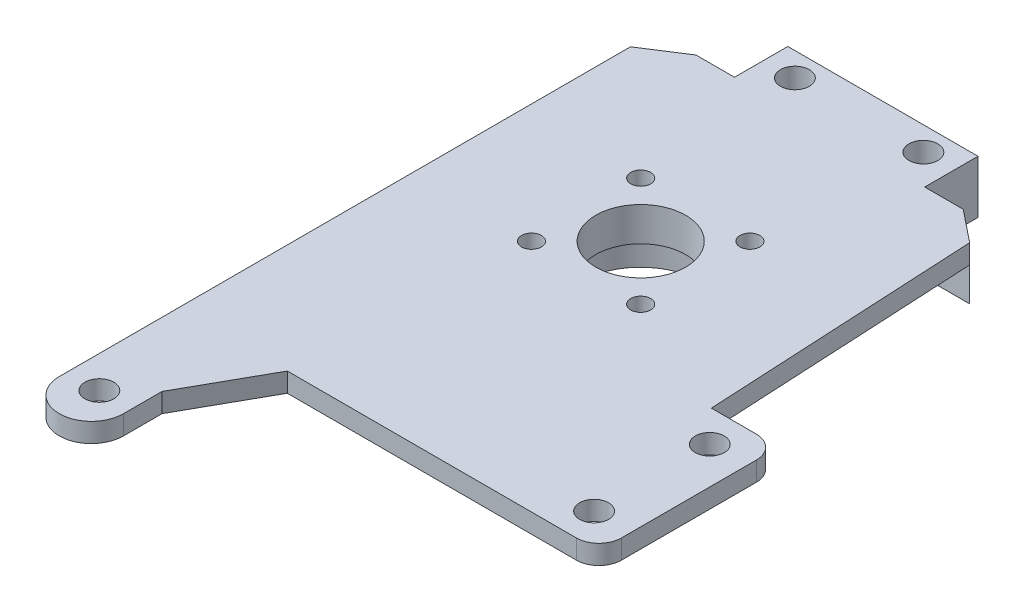
from build123d import *

# Parameters (mm, degrees)
SKETCH1_R                = 12.6
SKETCH1_R_2              = 2.25
BOSS_EXTRUDE1_DEPTH      = 3
BOSS_EXTRUDE2_DEPTH      = 3
BOSS_EXTRUDE2_DEPTH_BACK = 7.3
SKETCH1_23_R             = 12.6
SKETCH1_23_R_2           = 9.6
BOSS_EXTRUDE3_DEPTH      = 3
BOSS_EXTRUDE3_DEPTH_BACK = 2.3
SKETCH1_24_R             = 9.6
SKETCH1_24_R_2           = 7
CUT_EXTRUDE1_DEPTH       = 110.735090103
CUT_EXTRUDE1_DEPTH_BACK  = 110.735090103
SKETCH2_R                = 7
SKETCH2_R_2              = 1.55
BOSS_EXTRUDE4_DEPTH      = 3
BOSS_EXTRUDE4_DEPTH_BACK = 5.25
SKETCH1_25_R             = 2.25


with BuildPart() as part:
    # Sketch1 → Boss-Extrude1 (new body)
    with BuildSketch(Plane(origin=(0, 0, 0), x_dir=(1, 0, 0), z_dir=(0, 1, 0))):
        with BuildLine():
            Line((-20.8, -4.6), (-27, -8.6))
            Line((-27, -8.6), (-27, -97.5))
            ThreePointArc((-27, -97.5), (-22, -102.5), (-17, -97.5))
            Line((-17, -97.5), (-17, -91.5))
            Line((-17, -91.5), (-10, -79))
            Line((-10, -79), (35, -79))
            ThreePointArc((35, -79), (37.474873734, -77.974873734), (38.5, -75.5))
            Line((38.5, -75.5), (38.5, -54.5))
            ThreePointArc((38.5, -54.5), (37.474873734, -52.025126266), (35, -51))
            Line((35, -51), (28, -51))
            Line((28, -51), (25.8, -8.6))
            Line((25.8, -8.6), (20.8, -4.6))
            Line((20.8, -4.6), (-20.8, -4.6))
        make_face()
        with Locations((0, -34)):
            Circle(SKETCH1_R, mode=Mode.SUBTRACT)
        with Locations((32.75, -56)):
            Circle(SKETCH1_R_2, mode=Mode.SUBTRACT)
        with Locations((32.75, -74)):
            Circle(SKETCH1_R_2, mode=Mode.SUBTRACT)
        with Locations((-22, -96.25)):
            Circle(SKETCH1_R_2, mode=Mode.SUBTRACT)
    extrude(amount=BOSS_EXTRUDE1_DEPTH)

    # Sketch1<23> → Boss-Extrude2 (add, two sides: drawn at the far end of the back side and taken through both)
    with BuildSketch(Plane(origin=(0, 0, 0), x_dir=(1, 0, 0), z_dir=(0, 1, 0)).offset(-BOSS_EXTRUDE2_DEPTH_BACK)):
        with Locations((0, -34)):
            Circle(SKETCH1_23_R)
        with Locations((0, -34)):
            Circle(SKETCH1_23_R_2, mode=Mode.SUBTRACT)
    extrude(amount=BOSS_EXTRUDE2_DEPTH + BOSS_EXTRUDE2_DEPTH_BACK)

    # Sketch1<24> → Boss-Extrude3 (add, two sides: drawn at the far end of the back side and taken through both)
    with BuildSketch(Plane(origin=(0, 0, 0), x_dir=(1, 0, 0), z_dir=(0, 1, 0)).offset(-BOSS_EXTRUDE3_DEPTH_BACK)):
        with Locations((0, -34)):
            Circle(SKETCH1_24_R)
        with Locations((0, -34)):
            Circle(SKETCH1_24_R_2, mode=Mode.SUBTRACT)
    extrude(amount=BOSS_EXTRUDE3_DEPTH + BOSS_EXTRUDE3_DEPTH_BACK)

    # Sketch2 → Cut-Extrude1 (cut, two sides: drawn at the far end of the back side and taken through both)
    with BuildSketch(Plane(origin=(0, 0, 0), x_dir=(1, 0, 0), z_dir=(0, 1, 0)).offset(-CUT_EXTRUDE1_DEPTH_BACK)):
        with Locations((0, -34)):
            Circle(SKETCH2_R)
        with Locations((-8.5, -25.5)):
            Circle(SKETCH2_R_2)
        with Locations((8.5, -25.5)):
            Circle(SKETCH2_R_2)
        with Locations((8.5, -42.5)):
            Circle(SKETCH2_R_2)
        with Locations((-8.5, -42.5)):
            Circle(SKETCH2_R_2)
    extrude(amount=CUT_EXTRUDE1_DEPTH + CUT_EXTRUDE1_DEPTH_BACK, mode=Mode.SUBTRACT)

    # Sketch1<25> → Boss-Extrude4 (add, two sides: drawn at the far end of the back side and taken through both)
    with BuildSketch(Plane(origin=(0, 0, 0), x_dir=(1, 0, 0), z_dir=(0, 1, 0)).offset(-BOSS_EXTRUDE4_DEPTH_BACK)):
        Polygon((14.8, 3.7), (-14.8, 3.7), (-14.8, -4.6), (-20.8, -4.6), (-27, -8.6), (25.8, -8.6), (20.8, -4.6), (14.8, -4.6), align=None)
        with Locations((-10, 0)):
            Circle(SKETCH1_25_R, mode=Mode.SUBTRACT)
        with Locations((10, 0)):
            Circle(SKETCH1_25_R, mode=Mode.SUBTRACT)
    extrude(amount=BOSS_EXTRUDE4_DEPTH + BOSS_EXTRUDE4_DEPTH_BACK)


solid = part.part
